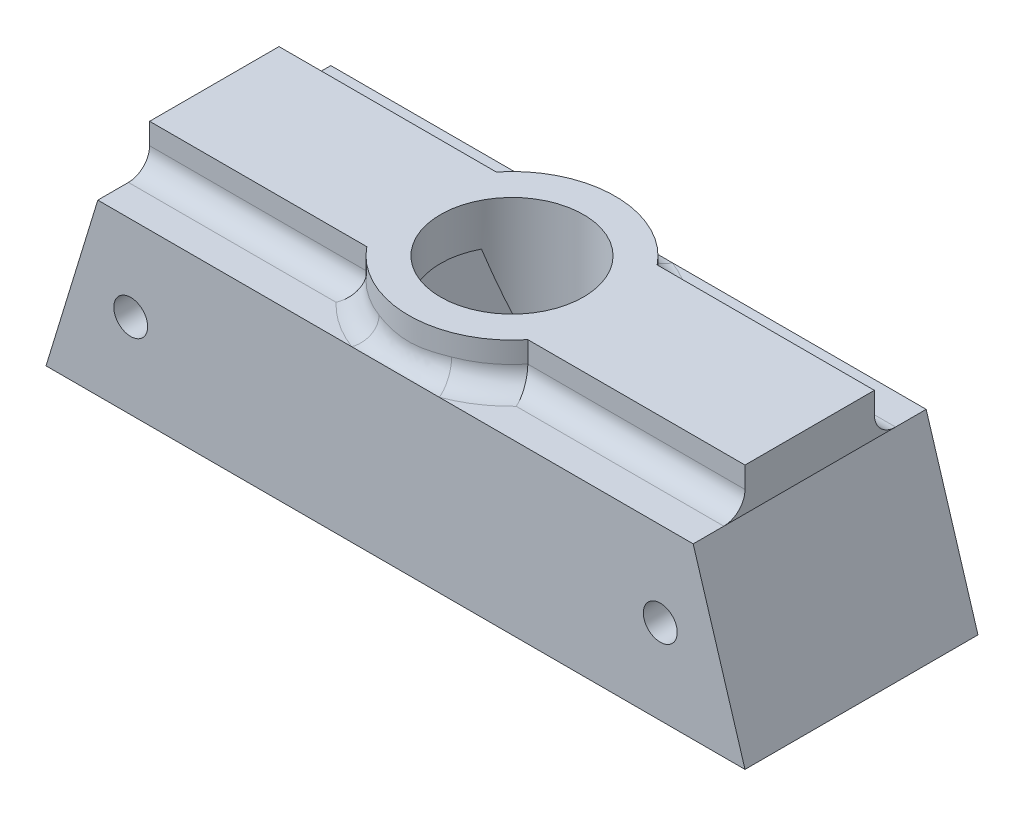
from build123d import *

# Parameters (mm, degrees)
SKETCH1_W           = 33
SKETCH1_H           = 11
SKETCH1_W_2         = 30
SKETCH1_H_2         = 8
BOSS_EXTRUDE1_DEPTH = 8
SKETCH1_6_W         = 30
SKETCH1_6_H         = 8
CUT_EXTRUDE1_DEPTH  = 8
CUT_EXTRUDE1_TAPER  = 17
CUT_EXTRUDE3_REACH  = 23.383
SKETCH3_R           = 0.8
BOSS_EXTRUDE6_DEPTH = 2
CUT_EXTRUDE4_DEPTH  = 23.209232315
CUT_EXTRUDE5_START  = -5.955717
SKETCH5_R           = 3.375
CUT_EXTRUDE5_DEPTH  = 7.955717
SKETCH6_W           = 30.5
SKETCH6_H           = 8.5
CUT_EXTRUDE6_DEPTH  = 2.25
FILLET1_R           = 1


with BuildPart() as part:
    # Sketch1 → Boss-Extrude1 (new body)
    # profile 1 of 2: a face of its own
    with BuildSketch(Plane(origin=(0, 0, 0), x_dir=(1, 0, 0), z_dir=(0, 1, 0))):
        Rectangle(SKETCH1_W, SKETCH1_H)
        Rectangle(SKETCH1_W_2, SKETCH1_H_2, mode=Mode.SUBTRACT)
    # profile 2 of 2: a face of its own
    with BuildSketch(Plane(origin=(0, 0, 0), x_dir=(1, 0, 0), z_dir=(0, 1, 0))):
        Rectangle(SKETCH1_W_2, SKETCH1_H_2)
    extrude(amount=BOSS_EXTRUDE1_DEPTH)

    # Sketch1<6> → Cut-Extrude1 (cut)
    with BuildSketch(Plane(origin=(0, 0, 0), x_dir=(1, 0, 0), z_dir=(0, 1, 0))):
        Rectangle(SKETCH1_6_W, SKETCH1_6_H)
    extrude(amount=CUT_EXTRUDE1_DEPTH, taper=CUT_EXTRUDE1_TAPER, mode=Mode.SUBTRACT)

    # Cut-Extrude3: up to this plane
    cut_extrude3_end = Plane(origin=(0, 0, 4), z_dir=(0, 0.2923717047227373, 0.9563047559630353))
    # Sketch3 → Cut-Extrude3 (cut, up to the surface)
    with BuildSketch(Plane.XY.offset(5.5), mode=Mode.PRIVATE) as cut_extrude3_sk1:
        with Locations((-12.5, 4)):
            Circle(SKETCH3_R)
    cut_extrude3_tool1 = split(extrude(cut_extrude3_sk1.sketch, amount=-CUT_EXTRUDE3_REACH, mode=Mode.PRIVATE), bisect_by=cut_extrude3_end, keep=Keep.BOTH, mode=Mode.PRIVATE)
    # Sketch3 → Cut-Extrude3 (cut, up to the surface)
    with BuildSketch(Plane.XY.offset(5.5), mode=Mode.PRIVATE) as cut_extrude3_sk2:
        with Locations((12.5, 4)):
            Circle(SKETCH3_R)
    cut_extrude3_tool2 = split(extrude(cut_extrude3_sk2.sketch, amount=-CUT_EXTRUDE3_REACH, mode=Mode.PRIVATE), bisect_by=cut_extrude3_end, keep=Keep.BOTH, mode=Mode.PRIVATE)
    cut_extrude3 = cut_extrude3_tool1.solids().sort_by_distance((-12.5, 4, 5.5))[0] + cut_extrude3_tool2.solids().sort_by_distance((12.5, 4, 5.5))[0]
    add(cut_extrude3, mode=Mode.SUBTRACT)

    # Mirror1: Cut-Extrude3 across plane
    add(cut_extrude3.mirror(Plane.XY), mode=Mode.SUBTRACT)

    # Sketch2<6> → Boss-Extrude6 (add)
    with BuildSketch(Plane(origin=(0, 8, 0), x_dir=(1, 0, 0), z_dir=(0, 1, 0))):
        with BuildLine():
            Line((3.799705909, -3.054154548), (14.054154548, -3.054154548))
            Line((14.054154548, -3.054154548), (14.054154548, 3.054154548))
            Line((14.054154548, 3.054154548), (3.799705909, 3.054154548))
            ThreePointArc((3.799705909, 3.054154548), (0, 4.875), (-3.799705909, 3.054154548))
            Line((-3.799705909, 3.054154548), (-14.054154548, 3.054154548))
            Line((-14.054154548, 3.054154548), (-14.054154548, -3.054154548))
            Line((-14.054154548, -3.054154548), (-3.799705909, -3.054154548))
            ThreePointArc((-3.799705909, -3.054154548), (0, -4.875), (3.799705909, -3.054154548))
        make_face()
        with BuildLine():
            ThreePointArc((2.995868595, 1.554154548), (3.375, 0), (2.995868595, -1.554154548))
            Line((2.995868595, -1.554154548), (1.626992206, -1.554154548))
            ThreePointArc((1.626992206, -1.554154548), (0, -2.25), (-1.626992206, -1.554154548))
            Line((-1.626992206, -1.554154548), (-2.995868595, -1.554154548))
            ThreePointArc((-2.995868595, -1.554154548), (-3.375, 0), (-2.995868595, 1.554154548))
            Line((-2.995868595, 1.554154548), (-1.626992206, 1.554154548))
            ThreePointArc((-1.626992206, 1.554154548), (0, 2.25), (1.626992206, 1.554154548))
            Line((1.626992206, 1.554154548), (2.995868595, 1.554154548))
        make_face(mode=Mode.SUBTRACT)
    extrude(amount=BOSS_EXTRUDE6_DEPTH)

    # Sketch4 → Cut-Extrude4 (cut, through all)
    with BuildSketch(Plane.XY.offset(5.5)):
        Polygon((-16.5, 0), (-14.054154548, 8), (-16.5, 8), align=None)
        Polygon((16.5, 0), (14.054154548, 8), (16.5, 8), align=None)
    extrude(amount=-CUT_EXTRUDE4_DEPTH, mode=Mode.SUBTRACT)

    # Sketch5 → Cut-Extrude5 (cut)
    with BuildSketch(Plane(origin=(0, 8, 0), x_dir=(1, 0, 0), z_dir=(0, 1, 0)).offset(CUT_EXTRUDE5_START)):
        with Locations(Location((0, 0, 0), (0, 0, 27.418746095))):
            Circle(SKETCH5_R)
    extrude(amount=CUT_EXTRUDE5_DEPTH, mode=Mode.SUBTRACT)

    # Sketch6 → Cut-Extrude6 (cut)
    with BuildSketch(Plane.XZ):
        Rectangle(SKETCH6_W, SKETCH6_H)
    extrude(amount=-CUT_EXTRUDE6_DEPTH, mode=Mode.SUBTRACT)

    # Fillet1
    fillet1_edges = [part.edges().sort_by_distance(p)[0] for p in [
        (8.926930229, 8, 3.054154548),
        (-8.926930229, 8, -3.054154548),
        (0, 8, -4.875),
        (-8.926930229, 8, 3.054154548),
        (0, 8, 4.875),
        (8.926930229, 8, -3.054154548),
    ]]
    fillet(fillet1_edges, radius=FILLET1_R)


solid = part.part
